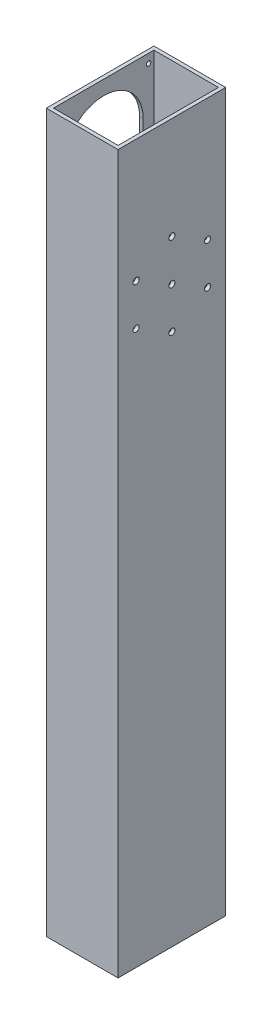
from build123d import *

# Parameters (mm, degrees)
SKETCH1_W                         = 40
SKETCH1_H                         = 60
SKETCH1_W_2                       = 36
SKETCH1_H_2                       = 56
BOSS_EXTRUDE1_DEPTH               = 400
M3_CLEARANCE_HOLE1_D              = 3.4
CUT_EXTRUDE1_DEPTH                = 3
TAP_DRILL_FOR_M3_TAP1_D           = 2.5
TAP_DRILL_FOR_M3_TAP1_DEPTH       = 2
TAP_DRILL_FOR_M3_TAP1_CSINK_D     = 3
TAP_DRILL_FOR_M3_TAP1_CSINK_ANGLE = 90


with BuildPart() as part:
    # Sketch1 → Boss-Extrude1 (new body)
    with BuildSketch(Plane(origin=(0, 0, 0), x_dir=(1, 0, 0), z_dir=(0, 1, 0))):
        with Locations((20, 30)):
            Rectangle(SKETCH1_W, SKETCH1_H)
        with Locations((20, 30)):
            Rectangle(SKETCH1_W_2, SKETCH1_H_2, mode=Mode.SUBTRACT)
    extrude(amount=BOSS_EXTRUDE1_DEPTH)

    # M3 Clearance Hole1 (through all)
    with Locations(Plane(origin=(40, 0, 0), x_dir=(0, 0, -1), z_dir=(1, 0, 0))):
        with Locations((30, 320), (30, 343), (49.918584287, 331.5), (49.918584287, 308.5), (30, 297), (10.081415713, 308.5), (10.081415713, 331.5)):
            Hole(M3_CLEARANCE_HOLE1_D / 2)

    # Sketch4 → Cut-Extrude1 (cut)
    with BuildSketch(Plane.ZY):
        with BuildLine():
            Line((-52, 270), (-52, 370))
            ThreePointArc((-52, 370), (-30, 392), (-8, 370))
            Line((-8, 370), (-8, 270))
            ThreePointArc((-8, 270), (-30, 248), (-52, 270))
        make_face()
    extrude(amount=-CUT_EXTRUDE1_DEPTH, mode=Mode.SUBTRACT)

    # Tap Drill for M3 Tap1
    with Locations(Plane.ZY):
        with Locations((-5, 245), (-55, 395), (-55, 245), (-55, 345), (-55, 295), (-5, 395), (-5, 345), (-5, 295)):
            CounterSinkHole(TAP_DRILL_FOR_M3_TAP1_D / 2, TAP_DRILL_FOR_M3_TAP1_CSINK_D / 2, depth=TAP_DRILL_FOR_M3_TAP1_DEPTH, counter_sink_angle=TAP_DRILL_FOR_M3_TAP1_CSINK_ANGLE)


solid = part.part
